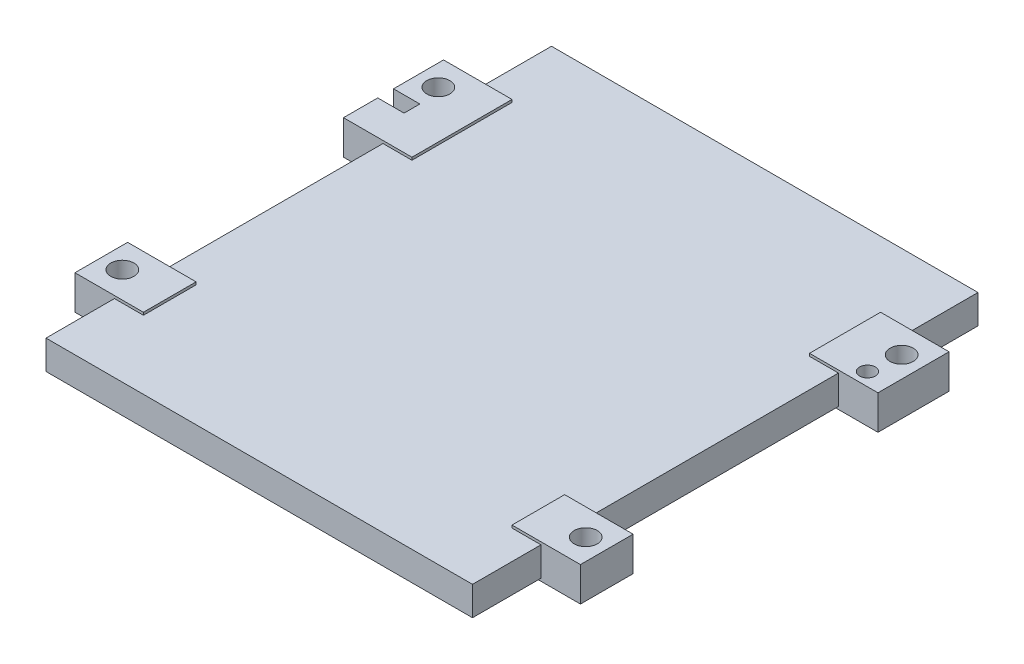
from build123d import *

# Parameters (mm, degrees)
EXTRUDE_3_DEPTH      = 5.5
EXTRUDE_4_DEPTH      = 6
EXTRUDE_4_DEPTH_BACK = 0.5
SKETCH_5_W           = 13
SKETCH_5_H           = 10
SKETCH_5_R           = 2.2
SKETCH_5_H_2         = 13.5
SKETCH_5_R_2         = 1.5


with BuildPart() as part:
    # Эскиз4 → Бобышка-Вытянуть3 (new body)
    with BuildSketch(Plane(origin=(0, 0, 0), x_dir=(1, 0, 0), z_dir=(0, 1, 0))):
        Polygon((-40.5, -48), (40.5, -48), (40.5, -35), (35, -35), (35, -25), (40.5, -25), (40.5, 21.5), (35, 21.5), (35, 35), (40.5, 35), (40.5, 48), (-40.5, 48), (-40.5, 35), (-35, 35), (-35, 16), (-40.5, 16), (-40.5, -25), (-35, -25), (-35, -35), (-40.5, -35), align=None)
    extrude(amount=EXTRUDE_3_DEPTH)

    # Эскиз5 → Бобышка-Вытянуть4 (add, two sides: drawn at the far end of the back side and taken through both)
    # profile 1 of 4: a face of its own
    with BuildSketch(Plane(origin=(0, 0, 0), x_dir=(1, 0, 0), z_dir=(0, 1, 0)).offset(-EXTRUDE_4_DEPTH_BACK)):
        with Locations((41.5, -30)):
            Rectangle(SKETCH_5_W, SKETCH_5_H)
        with Locations(Location((44, -30, 0), (0, 0, 270))):
            Circle(SKETCH_5_R, mode=Mode.SUBTRACT)
    # profile 2 of 4: a face of its own
    with BuildSketch(Plane(origin=(0, 0, 0), x_dir=(1, 0, 0), z_dir=(0, 1, 0)).offset(-EXTRUDE_4_DEPTH_BACK)):
        with Locations((-41.5, -30)):
            Rectangle(SKETCH_5_W, SKETCH_5_H)
        with Locations(Location((-44, -30, 0), (0, 0, 270))):
            Circle(SKETCH_5_R, mode=Mode.SUBTRACT)
    # profile 3 of 4: a face of its own
    with BuildSketch(Plane(origin=(0, 0, 0), x_dir=(1, 0, 0), z_dir=(0, 1, 0)).offset(-EXTRUDE_4_DEPTH_BACK)):
        with Locations((41.5, 28.25)):
            Rectangle(SKETCH_5_W, SKETCH_5_H_2)
        with Locations(Location((44, 30, 0), (0, 0, 270))):
            Circle(SKETCH_5_R, mode=Mode.SUBTRACT)
        with Locations(Location((43.5, 24, 0), (0, 0, 270))):
            Circle(SKETCH_5_R_2, mode=Mode.SUBTRACT)
    # profile 4 of 4: a face of its own
    with BuildSketch(Plane(origin=(0, 0, 0), x_dir=(1, 0, 0), z_dir=(0, 1, 0)).offset(-EXTRUDE_4_DEPTH_BACK)):
        Polygon((-48, 16), (-35, 16), (-35, 35), (-48, 35), (-48, 25.5), (-43, 25.5), (-43, 22.5), (-48, 22.5), align=None)
        with Locations(Location((-44, 30, 0), (0, 0, 270))):
            Circle(SKETCH_5_R, mode=Mode.SUBTRACT)
    extrude(amount=EXTRUDE_4_DEPTH + EXTRUDE_4_DEPTH_BACK)


solid = part.part
